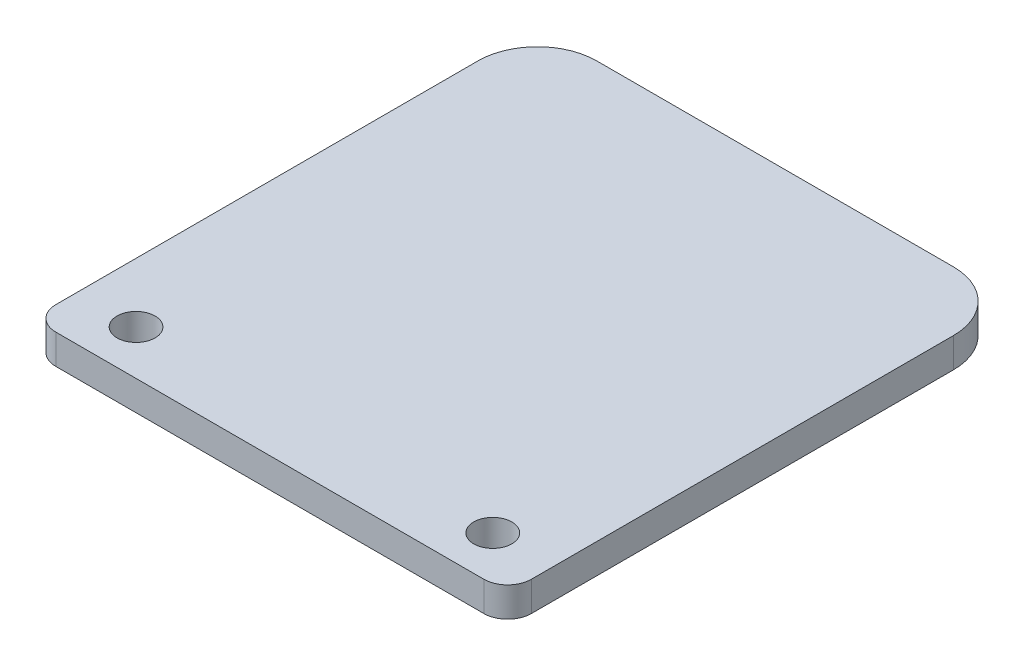
from build123d import *

# Parameters (mm, degrees)
SKETCH1_W           = 50.8
SKETCH1_H           = 53.975
BOSS_EXTRUDE1_DEPTH = 3.175
SKETCH2_R           = 2.032
CUT_EXTRUDE1_DEPTH  = 38.196314082
FILLET1_R           = 2.54
FILLET2_R           = 6.35


with BuildPart() as part:
    # Sketch1 → Boss-Extrude1 (new body)
    with BuildSketch(Plane(origin=(0, 0, 0), x_dir=(1, 0, 0), z_dir=(0, 1, 0))):
        Rectangle(SKETCH1_W, SKETCH1_H)
    extrude(amount=BOSS_EXTRUDE1_DEPTH)

    # Sketch2 → Cut-Extrude1 (cut, through all)
    with BuildSketch(Plane(origin=(0, 0, 0), x_dir=(-1, 0, 0), z_dir=(0, -1, 0))):
        with Locations(Location((-19.05, -22.225, 0), (0, 0, 90))):
            Circle(SKETCH2_R)
        with Locations(Location((19.05, -22.225, 0), (0, 0, 90))):
            Circle(SKETCH2_R)
    extrude(amount=-CUT_EXTRUDE1_DEPTH, mode=Mode.SUBTRACT)

    # Fillet1
    fillet1_edges = [part.edges().sort_by_distance(p)[0] for p in [
        (25.4, 1.5875, 26.9875),
        (-25.4, 1.5875, 26.9875),
    ]]
    fillet(fillet1_edges, radius=FILLET1_R)

    # Fillet2
    fillet2_edges = [part.edges().sort_by_distance(p)[0] for p in [
        (-25.4, 1.5875, -26.9875),
        (25.4, 1.5875, -26.9875),
    ]]
    fillet(fillet2_edges, radius=FILLET2_R)


solid = part.part
